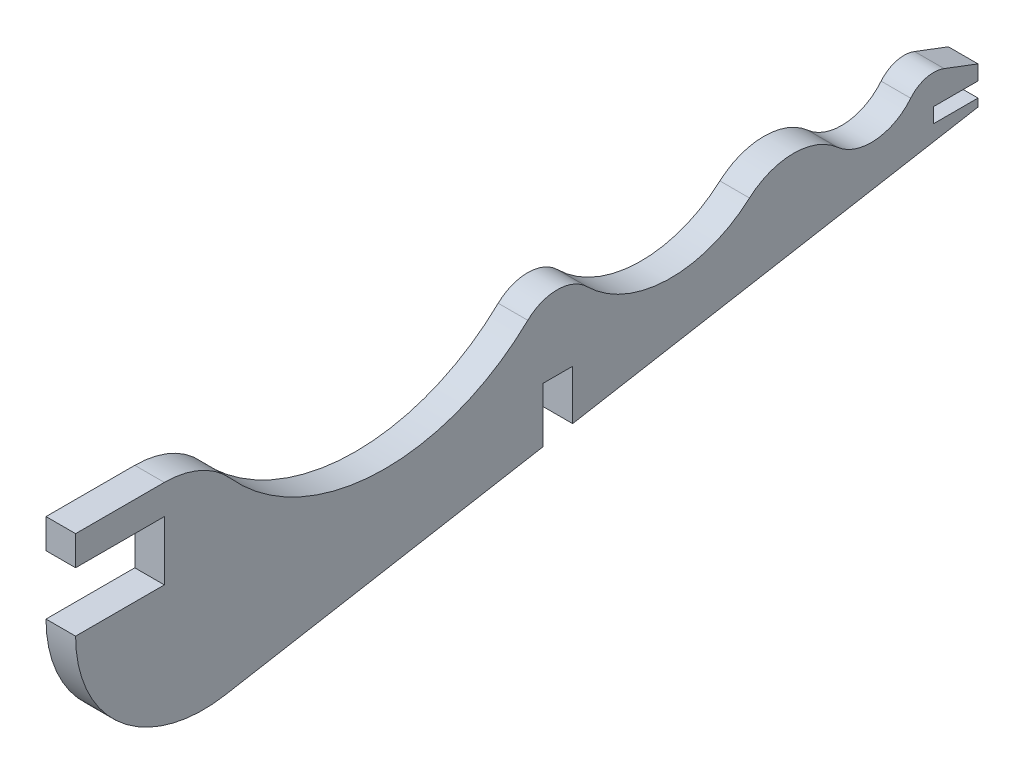
from build123d import *

# Parameters (mm, degrees)
BOSS_EXTRUDE1_DEPTH = 6.35
SKETCH2_W           = 6.35
SKETCH2_H           = 11.789754461
CUT_EXTRUDE1_DEPTH  = 206.585562738
CUT_EXTRUDE2_DEPTH  = 206.585562738


with BuildPart() as part:
    # Sketch1 → Boss-Extrude1 (new body)
    with BuildSketch(Plane(origin=(0, 0, 0), x_dir=(0, 0, -1), z_dir=(1, 0, 0))):
        with BuildLine():
            Line((-19.05, 0), (-19.05, 3.175))
            Line((-19.05, 3.175), (0, 3.175))
            Line((0, 3.175), (0, 9.525))
            Line((0, 9.525), (-19.05, 9.525))
            ThreePointArc((-19.05, 9.525), (-21.772170288, 8.911923298), (-23.968703037, 7.191075252))
            ThreePointArc((-23.968703037, 7.191075252), (-31.563196652, 3.209635371), (-39.693056937, 5.936092509))
            ThreePointArc((-39.693056937, 5.936092509), (-49.128661086, 9.524999891), (-58.565155627, 5.938434313))
            ThreePointArc((-58.565155627, 5.938434313), (-76.175633399, -0.485223061), (-93.413507935, 6.880099943))
            ThreePointArc((-93.413507935, 6.880099943), (-99.75616874, 9.524590732), (-106.147751964, 7.000637182))
            ThreePointArc((-106.147751964, 7.000637182), (-138.580790239, -5.246129508), (-169.944766377, 9.525))
            ThreePointArc((-169.944766377, 9.525), (-176.370039167, 14.215248831), (-184.15, 15.875))
            Line((-184.15, 15.875), (-203.2, 15.875))
            Line((-203.2, 15.875), (-203.2, 9.525))
            Line((-203.2, 9.525), (-184.15, 9.525))
            Line((-184.15, 9.525), (-184.15, -3.175))
            Line((-184.15, -3.175), (-203.2, -3.175))
            ThreePointArc((-203.2, -3.175), (-193.412202449, -24.164999585), (-171.041454914, -30.159223321))
            Line((-171.041454914, -30.159223321), (-9.525, -1.679514491))
            Line((-9.525, -1.679514491), (-9.525, 0))
            Line((-9.525, 0), (-19.05, 0))
        make_face()
    extrude(amount=BOSS_EXTRUDE1_DEPTH)

    # Sketch2 → Cut-Extrude1 (cut, through all)
    with BuildSketch(Plane(origin=(6.35, 0, 0), x_dir=(0, 0, -1), z_dir=(1, 0, 0))):
        with Locations((-99.700659688, -12.244877231)):
            Rectangle(SKETCH2_W, SKETCH2_H)
    extrude(amount=-CUT_EXTRUDE1_DEPTH, mode=Mode.SUBTRACT)

    # Sketch3 → Cut-Extrude2 (cut, through all)
    with BuildSketch(Plane(origin=(6.35, 0, 0), x_dir=(0, 0, -1), z_dir=(1, 0, 0))):
        with BuildLine():
            Line((-9.525, 3.175), (-9.525, 6.35))
            Line((-9.525, 6.35), (-16.795425987, 9.11127796))
            ThreePointArc((-16.795425987, 9.11127796), (-17.903890286, 9.420713132), (-19.05, 9.525))
            Line((-19.05, 9.525), (0, 9.525))
            Line((0, 9.525), (0, 3.175))
            Line((0, 3.175), (-9.525, 3.175))
        make_face()
    extrude(amount=-CUT_EXTRUDE2_DEPTH, mode=Mode.SUBTRACT)


solid = part.part
